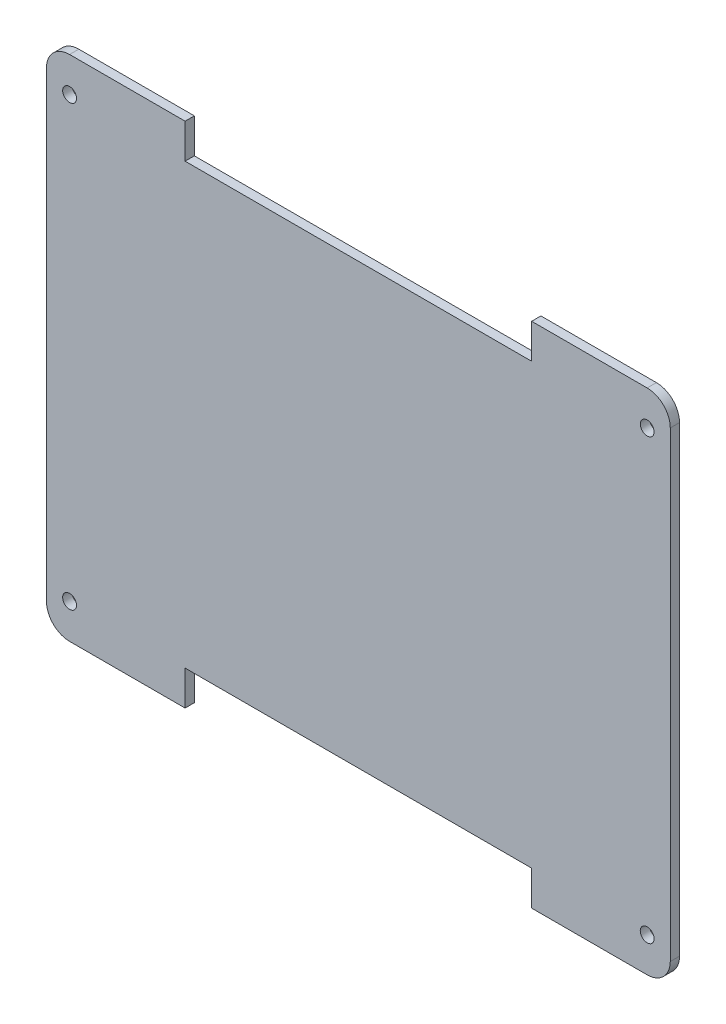
from build123d import *

# Parameters (mm, degrees)
SKETCH1_R               = 3
SKETCH1_W               = 33
SKETCH1_H               = 80
BOSS_EXTRUDE1_DEPTH     = 14
SKETCH4_R               = 2
CUT_EXTRUDE2_DEPTH      = 10
SKETCH5_R               = 2
CUT_EXTRUDE3_DEPTH      = 10
SKETCH6_R               = 3
BOSS_EXTRUDE2_DEPTH     = 4
BOSS_EXTRUDE2_2_DEPTH   = 4
SKETCH7_R               = 6.85
SKETCH7_R_2             = 1.5
CUT_EXTRUDE4_DEPTH      = 10
ESQUISSE2_W             = 270
ESQUISSE2_H             = 10
ENL_V_MAT_EXTRU_1_DEPTH = 260
ESQUISSE3_W             = 4
ESQUISSE3_H             = 176.46718548
BOSS_EXTRU_3_DEPTH      = 265


with BuildPart() as part:
    # Sketch1 → Boss-Extrude1 (new body)
    with BuildSketch(Plane.XY):
        Polygon((-135, -20.635083269), (-135, -50), (135, -50), (135, -20.635083269), (135, 40), (135, 50), (-135, 50), (-135, 40), align=None)
        with Locations((-85, -43)):
            Circle(SKETCH1_R, mode=Mode.SUBTRACT)
        with Locations((-80, 43)):
            Circle(SKETCH1_R, mode=Mode.SUBTRACT)
        with Locations(Location((80, 43, 0), (0, 0, 180))):
            Circle(SKETCH1_R, mode=Mode.SUBTRACT)
        with Locations(Location((85, -43, 0), (0, 0, 180))):
            Circle(SKETCH1_R, mode=Mode.SUBTRACT)
        with Locations((-110.5, 0)):
            Rectangle(SKETCH1_W, SKETCH1_H, mode=Mode.SUBTRACT)
        Polygon((-61, -30), (-35, -30), (-35, -20), (-4, -20), (-4, 20), (-35, 20), (-35, 30), (-61, 30), align=None, mode=Mode.SUBTRACT)
        Polygon((35, 20), (35, 30), (61, 30), (61, -30), (35, -30), (35, -20), (4, -20), (4, 20), align=None, mode=Mode.SUBTRACT)
        with Locations((110.5, 5)):
            Rectangle(SKETCH1_W, SKETCH1_H, mode=Mode.SUBTRACT)
    extrude(amount=BOSS_EXTRUDE1_DEPTH)

    # Sketch4 → Cut-Extrude2 (cut)
    with BuildSketch(Plane(origin=(0, 0, 0), x_dir=(-1, 0, 0), z_dir=(0, 0, -1))):
        with Locations((-131.5, 5)):
            Circle(SKETCH4_R)
    cut_extrude2 = extrude(amount=-CUT_EXTRUDE2_DEPTH, mode=Mode.SUBTRACT)

    # Sketch5 → Cut-Extrude3 (cut)
    with BuildSketch(Plane(origin=(0, 0, 0), x_dir=(-1, 0, 0), z_dir=(0, 0, -1))):
        with Locations((-69, 5)):
            Circle(SKETCH5_R)
    cut_extrude3 = extrude(amount=-CUT_EXTRUDE3_DEPTH, mode=Mode.SUBTRACT)

    # Mirror1: Cut-Extrude2, Cut-Extrude3 across plane
    add(cut_extrude2.mirror(Plane.ZY), mode=Mode.SUBTRACT)
    add(cut_extrude3.mirror(Plane.ZY), mode=Mode.SUBTRACT)


with BuildPart() as body_2:
    # Sketch6 → Boss-Extrude2 (new body)
    with BuildSketch(Plane.XY.offset(14)):
        with BuildLine():
            Line((75, 110), (125, 110))
            ThreePointArc((125, 110), (132.071067812, 107.071067812), (135, 100))
            Line((135, 100), (135, 50))
            Line((135, 50), (-135, 50))
            Line((-135, 50), (-135, 100))
            ThreePointArc((-135, 100), (-132.071067812, 107.071067812), (-125, 110))
            Line((-125, 110), (-75, 110))
            Line((-75, 110), (-75, 95))
            Line((-75, 95), (75, 95))
            Line((75, 95), (75, 110))
        make_face()
        with Locations((-125, 95)):
            Circle(SKETCH6_R, mode=Mode.SUBTRACT)
        with Locations((125, 95)):
            Circle(SKETCH6_R, mode=Mode.SUBTRACT)
    extrude(amount=-BOSS_EXTRUDE2_DEPTH)

    # Combine1: union part
    add(part.part)


with BuildPart() as body_3:
    # Sketch6 → Boss-Extrude2 2 (new body)
    with BuildSketch(Plane.XY.offset(14)):
        with BuildLine():
            Line((75, -110), (75, -95))
            Line((75, -95), (-75, -95))
            Line((-75, -95), (-75, -110))
            Line((-75, -110), (-125, -110))
            ThreePointArc((-125, -110), (-132.071067812, -107.071067812), (-135, -100))
            Line((-135, -100), (-135, -50))
            Line((-135, -50), (135, -50))
            Line((135, -50), (135, -100))
            ThreePointArc((135, -100), (132.071067812, -107.071067812), (125, -110))
            Line((125, -110), (75, -110))
        make_face()
        with Locations(Location((125, -95, 0), (0, 0, 180))):
            Circle(SKETCH6_R, mode=Mode.SUBTRACT)
        with Locations(Location((-125, -95, 0), (0, 0, 180))):
            Circle(SKETCH6_R, mode=Mode.SUBTRACT)
    extrude(amount=-BOSS_EXTRUDE2_2_DEPTH)


with BuildPart() as body_2_1:
    add(body_2.part)

    # Combine2: union body 3
    add(body_3.part)

    # Sketch7 → Cut-Extrude4 (cut)
    with BuildSketch(Plane.XY.offset(14)):
        with Locations((0, 70)):
            Circle(SKETCH7_R)
        with Locations((-11.25, 76.495190528)):
            Circle(SKETCH7_R_2)
        with Locations((0, 57.009618943)):
            Circle(SKETCH7_R_2)
        with Locations((0, -70)):
            Circle(SKETCH7_R)
        with Locations((0, -57.009618943)):
            Circle(SKETCH7_R_2)
        with Locations(Location((11.25, 76.495190528, 0), (0, 0, 180))):
            Circle(SKETCH7_R_2)
        with Locations((-11.25, -76.495190528)):
            Circle(SKETCH7_R_2)
        with Locations((11.25, -76.495190528)):
            Circle(SKETCH7_R_2)
    extrude(amount=-CUT_EXTRUDE4_DEPTH, mode=Mode.SUBTRACT)

    # Esquisse2 → Enlèv. mat.-Extru.1 (cut)
    with BuildSketch(Plane.XZ.offset(50)):
        with Locations((0, 5)):
            Rectangle(ESQUISSE2_W, ESQUISSE2_H)
    extrude(amount=-ENL_V_MAT_EXTRU_1_DEPTH, mode=Mode.SUBTRACT)

    # Esquisse3 → Boss.-Extru.3 (add)
    with BuildSketch(Plane(origin=(135, 0, 0), x_dir=(0, 0, -1), z_dir=(1, 0, 0))):
        with Locations((-12, 0.244857916)):
            Rectangle(ESQUISSE3_W, ESQUISSE3_H)
    extrude(amount=-BOSS_EXTRU_3_DEPTH)


solid = body_2_1.part
